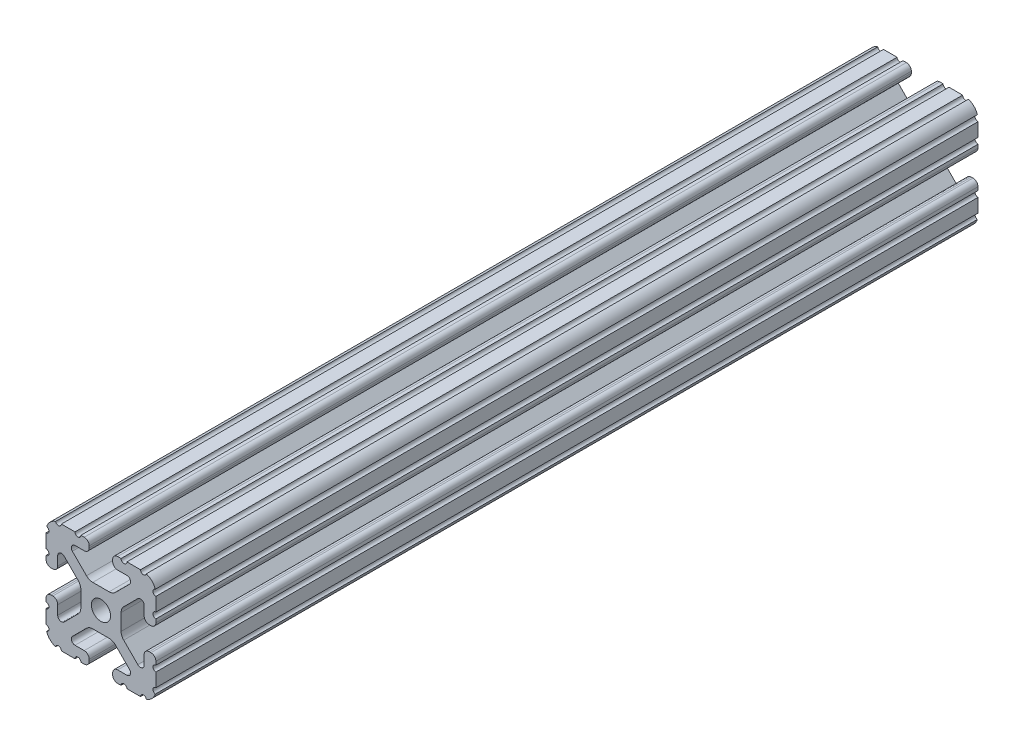
from build123d import *

# Parameters (mm, degrees)
BOSS_EXTRUDE1_DEPTH     = 142.515
CUT_EXTRUDE1_DEPTH      = 146.039064479
CUT_EXTRUDE1_DEPTH_BACK = 146.039064479
SKETCH5_R               = 1.016


with BuildPart() as part:
    # Sketch4 → Boss-Extrude1 (new, symmetric)
    with BuildSketch(Plane.XY):
        with BuildLine():
            Line((5.7912, -19.05), (14.3002, -19.05))
            ThreePointArc((14.3002, -19.05), (17.658815789, -17.658815789), (19.05, -14.3002))
            Line((19.05, -14.3002), (19.05, -5.7912))
            ThreePointArc((19.05, -5.7912), (18.544114832, -4.569885168), (17.3228, -4.064))
            Line((17.3228, -4.064), (16.7132, -4.064))
            ThreePointArc((16.7132, -4.064), (15.491885168, -4.569885168), (14.986, -5.7912))
            Line((14.986, -5.7912), (14.986, -8.996305235))
            ThreePointArc((14.986, -8.996305235), (14.189232738, -10.188751711), (12.782646215, -9.908964256))
            Line((12.782646215, -9.908964256), (7.888897763, -5.015215804))
            ThreePointArc((7.888897763, -5.015215804), (7.219915375, -4.014012907), (6.985, -2.833013566))
            Line((6.985, -2.833013566), (6.985, 0))
            Line((6.985, 0), (3.3274, 0))
            ThreePointArc((3.3274, 0), (2.352827104, -2.352827104), (0, -3.3274))
            Line((0, -3.3274), (0, -6.985))
            Line((0, -6.985), (2.833013566, -6.985))
            ThreePointArc((2.833013566, -6.985), (4.014012907, -7.219915375), (5.015215804, -7.888897763))
            Line((5.015215804, -7.888897763), (9.908964256, -12.782646215))
            ThreePointArc((9.908964256, -12.782646215), (10.188751711, -14.189232738), (8.996305235, -14.986))
            Line((8.996305235, -14.986), (5.7912, -14.986))
            ThreePointArc((5.7912, -14.986), (4.569885168, -15.491885168), (4.064, -16.7132))
            Line((4.064, -16.7132), (4.064, -17.3228))
            ThreePointArc((4.064, -17.3228), (4.569885168, -18.544114832), (5.7912, -19.05))
        make_face()
    extrude(amount=BOSS_EXTRUDE1_DEPTH, both=True)

    # Sketch5 → Cut-Extrude1 (cut, two sides: drawn at the far end of the back side and taken through both)
    with BuildSketch(Plane.XY.offset(-CUT_EXTRUDE1_DEPTH_BACK)):
        with Locations((14.739477062, -19.05)):
            Circle(SKETCH5_R)
        with Locations((7.980305235, -19.05)):
            Circle(SKETCH5_R)
        with Locations((19.05, -14.739477062)):
            Circle(SKETCH5_R)
        with Locations((19.05, -7.980305235)):
            Circle(SKETCH5_R)
    extrude(amount=CUT_EXTRUDE1_DEPTH + CUT_EXTRUDE1_DEPTH_BACK, mode=Mode.SUBTRACT)

    # Mirror1: part across plane


with BuildPart() as part_1:
    add(part.part)
    add(part.part.mirror(Plane(origin=(0, 0, 0), x_dir=(0, 0, 1), z_dir=(1, 0, 0))))

    # Mirror2: part across plane


with BuildPart() as part_2:
    add(part_1.part)
    add(part_1.part.mirror(Plane.ZX))


solid = part_2.part
